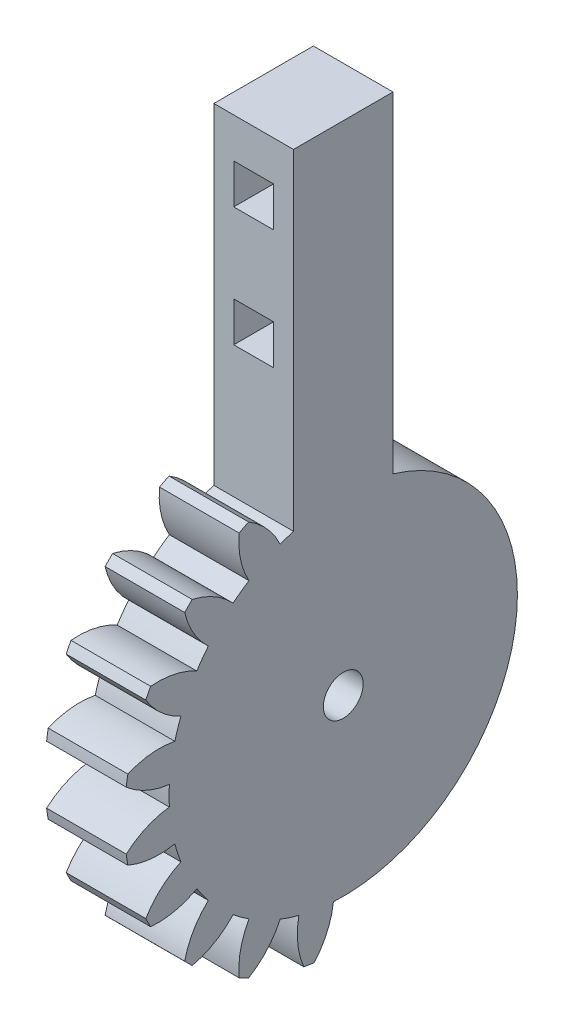
from build123d import *
from build123d.topology import SkipClean

# Parameters (mm, degrees)
BASPROSKE_W             = 10
BASPROSKE_H             = 22
TOOTHCUT_DEPTH          = 33.680269277
TEETHCUTS_COUNT         = 20
TEETHCUTS_ANGLE         = 342
BORSKE_R                = 2
BORE_DEPTH              = 50.0000508
SKETCH3_W               = 21.477286505
SKETCH3_H               = 49.38738346
SKETCH3_W_2             = 5.914035414
SKETCH3_H_2             = 19.713451381
CUT_EXTRUDE1_DEPTH      = 10
SKETCH4_R               = 17.499
SKETCH4_R_2             = 2
BOSS_EXTRUDE2_DEPTH     = 10
BOSS_EXTRUDE3_DEPTH     = 10
CUT_EXTRUDE3_DEPTH      = 56.733338326
CUT_EXTRUDE3_DEPTH_BACK = 56.733338326
SKETCH7_W               = 2
SKETCH7_H               = 71.806333941
SKETCH6_W               = 4
SKETCH6_H               = 4
CUT_EXTRUDE5_DEPTH      = 58.293800183


with BuildPart() as part:
    # BasProSke → Base-Revolve (revolve)
    with BuildSketch(Plane(origin=(0, 0, 0), x_dir=(1, 0, 0), z_dir=(0, 1, 0)), mode=Mode.PRIVATE) as base_revolve_sk:
        with Locations((5, 11)):
            Rectangle(BASPROSKE_W, BASPROSKE_H)
    revolve(base_revolve_sk.sketch.rotate(Axis((-10, 0, 0), (1, 0, 0)), 180), axis=Axis((-10, 0, 0), (1, 0, 0)))

    # TooCutSke → ToothCut (cut, through all)
    with BuildSketch(Plane(origin=(0, 0, 0), x_dir=(0, 0, -1), z_dir=(1, 0, 0))):
        with BuildLine():
            ThreePointArc((0.986171591, 17.471189616), (0, 17.499), (-0.986171591, 17.471189616))
            ThreePointArc((-0.986171591, 17.471189616), (-1.626916196, 19.798789858), (-2.932850173, 21.829260982))
            ThreePointArc((-2.932850173, 21.829260982), (0, 22.0254), (2.932850173, 21.829260982))
            ThreePointArc((2.932850173, 21.829260982), (1.626916196, 19.798789858), (0.986171591, 17.471189616))
        make_face()
    toothcut = extrude(amount=TOOTHCUT_DEPTH, mode=Mode.SUBTRACT)

    # TeethCuts: ToothCut ×20 about axis
    teethcuts_axis = Axis((-10, 0, 0), (1, 0, 0))
    for i in range(1, TEETHCUTS_COUNT):
        add(toothcut.rotate(teethcuts_axis, i * TEETHCUTS_ANGLE / (TEETHCUTS_COUNT - 1)), mode=Mode.SUBTRACT)

    # BorSke → Bore (cut, symmetric)
    with BuildSketch(Plane(origin=(0, 0, 0), x_dir=(0, 0, -1), z_dir=(1, 0, 0))):
        with Locations(Location((0, 0, 0), (0, 0, 180))):
            Circle(BORSKE_R)
    extrude(amount=BORE_DEPTH, both=True, mode=Mode.SUBTRACT)

    # Sketch3 → Cut-Extrude1 (cut)
    with BuildSketch(Plane.ZY):
        with Locations((-15.842569701, 2.389280872)):
            Rectangle(SKETCH3_W, SKETCH3_H)
        Polygon((-0.493085796, 27.082972602), (-5.103926448, 27.082972602), (-5.103926448, 10.689681454), (-0.493085796, 10.689681454), (-0.493085796, 17.471189616), (-0.986171591, 17.471189616), (-0.986171591, 17.499), (-0.493085796, 17.499), align=None)
        with Locations((-2.146908741, -12.447685168)):
            Rectangle(SKETCH3_W_2, SKETCH3_H_2)
    extrude(amount=-CUT_EXTRUDE1_DEPTH, mode=Mode.SUBTRACT)

    # Sketch4 → Boss-Extrude2 (add)
    with SkipClean():  # the faces are left unmerged after this step: merging them gives an invalid solid
        with BuildSketch(Plane.ZY):
            Circle(SKETCH4_R)
            Circle(SKETCH4_R_2, mode=Mode.SUBTRACT)
        extrude(amount=-BOSS_EXTRUDE2_DEPTH)

    # Sketch5 → Boss-Extrude3 (add)
    with BuildSketch(Plane.ZY):
        with BuildLine():
            ThreePointArc((4.460989585, 16.920832513), (4.73110018, 16.847305188), (5, 16.76946633))
            Line((5, 16.76946633), (5, 50))
            Line((5, 50), (-5, 50))
            Line((-5, 50), (-5, 16.76946633))
            ThreePointArc((-5, 16.76946633), (-2.037353312, 17.37999403), (0.986171591, 17.471189616))
            ThreePointArc((0.986171591, 17.471189616), (1.620704589, 19.784848102), (2.912696354, 21.806333941))
            ThreePointArc((2.912696354, 21.806333941), (3.441558231, 21.729143493), (3.968388926, 21.639128664))
            ThreePointArc((3.968388926, 21.639128664), (4.572472634, 19.317333972), (4.460989585, 16.920832513))
        make_face()
        with BuildLine():
            ThreePointArc((-2, 0), (0, 2), (2, 0))
            Line((2, 0), (5, 0))
            Line((5, 0), (5, 16.76946633))
            ThreePointArc((5, 16.76946633), (4.73110018, 16.847305188), (4.460989585, 16.920832513))
            ThreePointArc((4.460989585, 16.920832513), (4.572472634, 19.317333972), (3.968388926, 21.639128664))
            ThreePointArc((3.968388926, 21.639128664), (3.441558231, 21.729143493), (2.912696354, 21.806333941))
            ThreePointArc((2.912696354, 21.806333941), (1.620704589, 19.784848102), (0.986171591, 17.471189616))
            ThreePointArc((0.986171591, 17.471189616), (-2.037353312, 17.37999403), (-5, 16.76946633))
            Line((-5, 16.76946633), (-5, 0))
            Line((-5, 0), (-2, 0))
        make_face()
    extrude(amount=-BOSS_EXTRUDE3_DEPTH)

    # Sketch7 → Cut-Extrude3 (cut, two sides: drawn at the far end of the back side and taken through both)
    with BuildSketch(Plane.XY.offset(5).offset(-CUT_EXTRUDE3_DEPTH_BACK)):
        with Locations((9, 14.096833029)):
            Rectangle(SKETCH7_W, SKETCH7_H)
    extrude(amount=CUT_EXTRUDE3_DEPTH + CUT_EXTRUDE3_DEPTH_BACK, mode=Mode.SUBTRACT)

    # Sketch6 → Cut-Extrude5 (cut, through all)
    with BuildSketch(Plane(origin=(0, 0, -5), x_dir=(-1, 0, 0), z_dir=(0, 0, -1))):
        with Locations((-4, 44)):
            Rectangle(SKETCH6_W, SKETCH6_H)
        with Locations((-4, 32)):
            Rectangle(SKETCH6_W, SKETCH6_H)
    extrude(amount=-CUT_EXTRUDE5_DEPTH, mode=Mode.SUBTRACT)


solid = part.part
